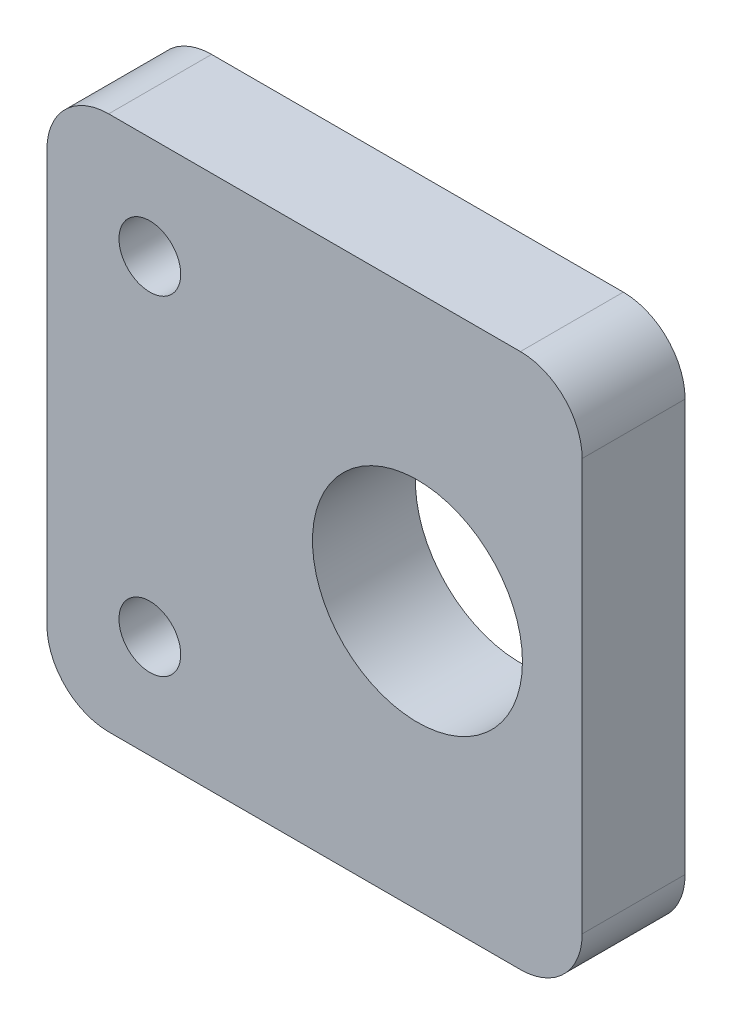
from build123d import *

# Parameters (mm, degrees)
CROQUIS1_W              = 26
CROQUIS1_H              = 26
CROQUIS1_R              = 5.1
CROQUIS1_R_2            = 1.5
SALIENTE_EXTRUIR1_DEPTH = 5
REDONDEO1_R             = 3


with BuildPart() as part:
    # Croquis1 → Saliente-Extruir1 (new body)
    with BuildSketch(Plane.XY):
        with Locations((-5, 0)):
            Rectangle(CROQUIS1_W, CROQUIS1_H)
        Circle(CROQUIS1_R, mode=Mode.SUBTRACT)
        with Locations((-13, 8)):
            Circle(CROQUIS1_R_2, mode=Mode.SUBTRACT)
        with Locations((-13, -8)):
            Circle(CROQUIS1_R_2, mode=Mode.SUBTRACT)
    extrude(amount=SALIENTE_EXTRUIR1_DEPTH)

    # Redondeo1
    redondeo1_edges = [part.edges().sort_by_distance(p)[0] for p in [
        (-18, -13, 2.5),
        (-18, 13, 2.5),
        (8, 13, 2.5),
        (8, -13, 2.5),
    ]]
    fillet(redondeo1_edges, radius=REDONDEO1_R)


solid = part.part
